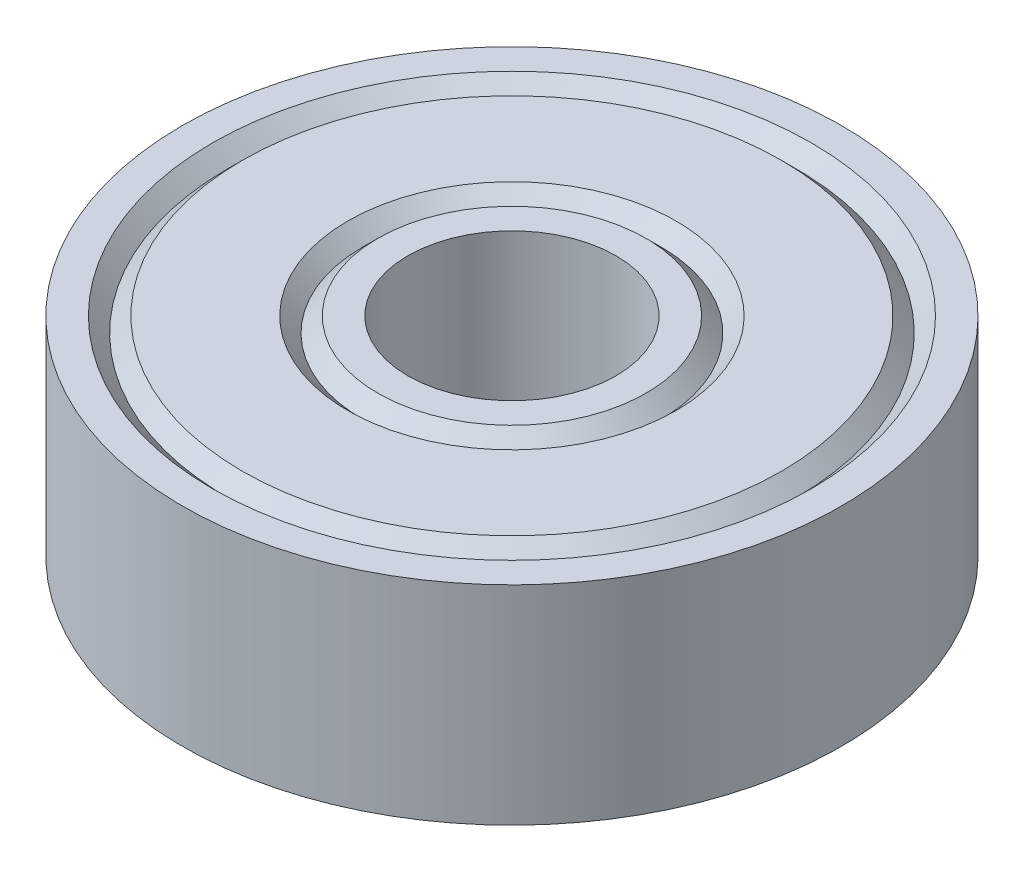
from build123d import *


with BuildPart() as part:
    # Sketch1 → Revolve1 (revolve)
    with BuildSketch(Plane.XY):
        Polygon((-3, 3), (-3.866666667, 3), (-4.3, 2.566666667), (-4.733333333, 3), (-7.766666667, 3), (-8.2, 2.566666667), (-8.633333333, 3), (-9.5, 3), (-9.5, -3), (-8.633333333, -3), (-8.2, -2.566666667), (-7.766666667, -3), (-4.733333333, -3), (-4.3, -2.566666667), (-3.866666667, -3), (-3, -3), align=None)
    revolve(axis=Axis((0, 3, 0), (0, -1, 0)))


solid = part.part
